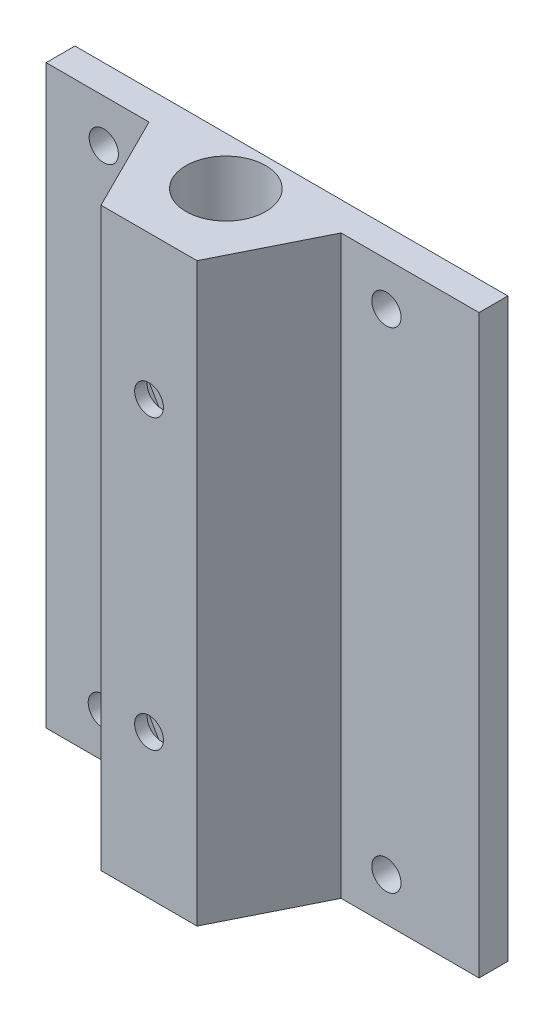
from build123d import *

# Parameters (mm, degrees)
SKETCH_1_W          = 45.073019954
SKETCH_1_H          = 60
SKETCH_1_R          = 1.525
EXTRUDE_1_DEPTH     = 3
SKETCH_2_W          = 10
SKETCH_2_H          = 60
EXTRUDE_2_DEPTH     = 10
HOLE_WIZARD_1_D     = 8.3
EXTRUDE_3_DEPTH     = 60
CUT_EXTRUDE_1_DEPTH = 0.7
HOLE_WIZARD_2_D     = 3
HOLE_WIZARD_2_DEPTH = 5


with BuildPart() as part:
    # 草图1 → 凸台-拉伸1 (new body)
    with BuildSketch(Plane.XY):
        with Locations((37.463490023, 30)):
            Rectangle(SKETCH_1_W, SKETCH_1_H)
        with Locations((20.831064203, 4.5)):
            Circle(SKETCH_1_R, mode=Mode.SUBTRACT)
        with Locations((50.351484989, 4.5)):
            Circle(SKETCH_1_R, mode=Mode.SUBTRACT)
        with Locations((20.926980046, 55.5)):
            Circle(SKETCH_1_R, mode=Mode.SUBTRACT)
        with Locations((50.351484989, 55.5)):
            Circle(SKETCH_1_R, mode=Mode.SUBTRACT)
    extrude(amount=EXTRUDE_1_DEPTH)

    # 草图2 → 凸台-拉伸2 (add)
    with BuildSketch(Plane.XY.offset(3)):
        with Locations((35.639232517, 30)):
            Rectangle(SKETCH_2_W, SKETCH_2_H)
    extrude(amount=EXTRUDE_2_DEPTH)

    # 孔1 (through all)
    with Locations(Plane(origin=(0, 0, 0), x_dir=(-1, 0, 0), z_dir=(0, -1, 0))):
        with Locations((-35.639232517, -5)):
            Hole(HOLE_WIZARD_1_D / 2)

    # 草图5 → 凸台-拉伸3 (add)
    with BuildSketch(Plane.XZ):
        Polygon((30.639232517, 13), (25.639232517, 3), (30.639232517, 3), align=None)
        Polygon((40.639232517, 13), (45.639232517, 3), (40.639232517, 3), align=None)
    extrude(amount=-EXTRUDE_3_DEPTH)

    # 草图7 → 切除-拉伸1 (cut, symmetric)
    with BuildSketch(Plane.XY.offset(11)):
        Polygon((37.313548298, 12.1), (38.987864079, 15), (37.313548298, 17.9), (33.964916737, 17.9), (32.290600956, 15), (33.964916737, 12.1), align=None)
        Polygon((38.987864079, 45), (37.313548298, 47.9), (33.964916737, 47.9), (32.290600956, 45), (33.964916737, 42.1), (37.313548298, 42.1), align=None)
    extrude(amount=CUT_EXTRUDE_1_DEPTH, both=True, mode=Mode.SUBTRACT)

    # 孔2
    with Locations(Plane.XY.offset(13)):
        with Locations((35.639232517, 45), (35.639232517, 15)):
            Hole(HOLE_WIZARD_2_D / 2, depth=HOLE_WIZARD_2_DEPTH)


solid = part.part
